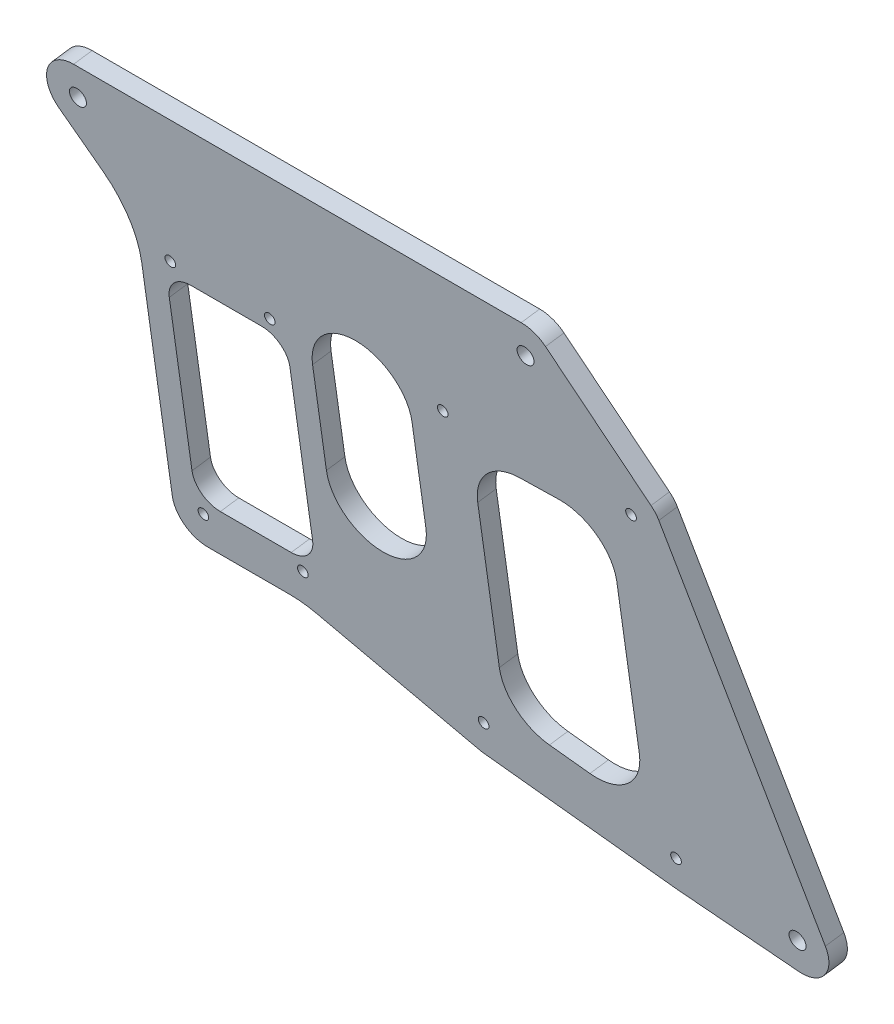
from build123d import *

# Parameters (mm, degrees)
SKETCH2_W                                         = 184.171135827
SKETCH2_H                                         = 127
BOSS_EXTRUDE1_DEPTH                               = 4.7625
CSK_FOR_6_FLAT_HEAD_MACHINE_SCREW_100_D           = 4.3053
CSK_FOR_6_FLAT_HEAD_MACHINE_SCREW_100_CSINK_D     = 7.0866
CSK_FOR_6_FLAT_HEAD_MACHINE_SCREW_100_CSINK_ANGLE = 100
CUT_EXTRUDE1_DEPTH                                = 2440.147405433
F_2_CLEARANCE_HOLE1_D                             = 2.7051
CUT_EXTRUDE2_DEPTH                                = 4.7625
FILLET1_R                                         = 25.4
SKETCH10_W                                        = 30.7975
SKETCH10_H                                        = 54.356
CUT_EXTRUDE3_DEPTH                                = 2440.147405433
FILLET2_R                                         = 6.35
CUT_EXTRUDE4_DEPTH                                = 2440.147405433
FILLET3_R                                         = 12.7


with BuildPart() as part:
    # Sketch2 → Boss-Extrude1 (new body)
    with BuildSketch(Plane(origin=(-1e-09, -851.606445574, 6059.494718221), x_dir=(-1, 0, 0), z_dir=(1.0892556339675399e-13, 0.13917310096006327, -0.9902680687415707))):
        with Locations((-199.574242123, -2357.490725166)):
            Rectangle(SKETCH2_W, SKETCH2_H)
    extrude(amount=BOSS_EXTRUDE1_DEPTH)

    # CSK for #6 Flat Head Machine Screw (100)1 (through all)
    with Locations(Plane(origin=(-1e-09, -850.94363368, 6054.778566544), x_dir=(-1, 0, 0), z_dir=(1.0707755897952407e-13, 0.13917310096005847, -0.9902680687415714))):
        with Locations((-115.42617421, -2301.928225166), (-229.72617421, -2301.928225166), (-283.722310037, -2413.053225166)):
            CounterSinkHole(CSK_FOR_6_FLAT_HEAD_MACHINE_SCREW_100_D / 2, CSK_FOR_6_FLAT_HEAD_MACHINE_SCREW_100_CSINK_D / 2, counter_sink_angle=CSK_FOR_6_FLAT_HEAD_MACHINE_SCREW_100_CSINK_ANGLE)

    # Sketch5 → Cut-Extrude1 (cut, through all)
    with BuildSketch(Plane(origin=(-1e-09, -850.94363368, 6054.778566544), x_dir=(-1, 0, 0), z_dir=(1.0707755897952407e-13, 0.13917310096005847, -0.9902680687415714))):
        with BuildLine():
            Line((-195.975000021, -2361.610724808), (-195.975000021, -2336.210724808))
            ThreePointArc((-195.975000021, -2336.210724808), (-183.275000021, -2323.510724808), (-170.575000021, -2336.210724808))
            Line((-170.575000021, -2336.210724808), (-170.575000021, -2361.610724808))
            ThreePointArc((-170.575000021, -2361.610724808), (-183.275000021, -2374.310724808), (-195.975000021, -2361.610724808))
        make_face()
    extrude(amount=-CUT_EXTRUDE1_DEPTH, mode=Mode.SUBTRACT)

    # #2 Clearance Hole1 (through all)
    with Locations(Plane(origin=(-1e-09, -850.94363368, 6054.778566544), x_dir=(-1, 0, 0), z_dir=(1.0707755897952407e-13, 0.13917310096005847, -0.9902680687415714))):
        with Locations((-135.015000021, -2391.392725166), (-160.415000021, -2391.392725166), (-160.415000021, -2330.686725166), (-135.015000021, -2330.686725166), (-204.864100021, -2328.675325166), (-204.864100021, -2403.605325166), (-253.124100021, -2409.955325166), (-253.124100021, -2327.405325166)):
            Hole(F_2_CLEARANCE_HOLE1_D / 2)

    # Sketch9 → Cut-Extrude2 (cut)
    with BuildSketch(Plane(origin=(-1e-09, -850.94363368, 6054.778566544), x_dir=(-1, 0, 0), z_dir=(1.0707755897952407e-13, 0.13917310096005847, -0.9902680687415714))):
        with BuildLine():
            Line((-252.324559302, -2417.852453814), (-282.922769318, -2420.950353814))
            ThreePointArc((-282.922769318, -2420.950353814), (-283.322030383, -2420.980625903), (-283.722310037, -2420.990725166))
            Line((-283.722310037, -2420.990725166), (-107.48867421, -2420.990725166))
            Line((-107.48867421, -2420.990725166), (-107.48867421, -2301.928225166))
            ThreePointArc((-107.48867421, -2301.928225166), (-108.092880421, -2304.96577491), (-109.813514134, -2307.540885241))
            Line((-109.813514134, -2307.540885241), (-127.077500021, -2324.804871128))
            Line((-127.077500021, -2324.804871128), (-127.077500021, -2391.392725166))
            ThreePointArc((-127.077500021, -2391.392725166), (-129.402339945, -2397.005385241), (-135.015000021, -2399.330225166))
            Line((-135.015000021, -2399.330225166), (-159.344404514, -2399.330225166))
            Line((-159.344404514, -2399.330225166), (-202.761165842, -2411.259185244))
            ThreePointArc((-202.761165842, -2411.259185244), (-203.291186027, -2411.385418213), (-203.828617327, -2411.474993637))
            Line((-203.828617327, -2411.474993637), (-252.088617327, -2417.824993637))
            ThreePointArc((-252.088617327, -2417.824993637), (-252.206485588, -2417.839606363), (-252.324559302, -2417.852453814))
        make_face()
        with BuildLine():
            Line((-291.659810037, -2293.990725166), (-291.659810037, -2413.053225166))
            ThreePointArc((-291.659810037, -2413.053225166), (-291.543281919, -2411.69812182), (-291.197118994, -2410.382806226))
            Line((-291.197118994, -2410.382806226), (-260.598908977, -2324.734906226))
            ThreePointArc((-260.598908977, -2324.734906226), (-259.919874258, -2323.303940185), (-258.970238667, -2322.036287154))
            Line((-258.970238667, -2322.036287154), (-235.572312857, -2296.559187154))
            ThreePointArc((-235.572312857, -2296.559187154), (-232.918913397, -2294.661154041), (-229.72617421, -2293.990725166))
            Line((-229.72617421, -2293.990725166), (-291.659810037, -2293.990725166))
        make_face()
        with BuildLine():
            ThreePointArc((-115.42617421, -2293.990725166), (-109.813514134, -2296.31556509), (-107.48867421, -2301.928225166))
            Line((-107.48867421, -2301.928225166), (-107.48867421, -2293.990725166))
            Line((-107.48867421, -2293.990725166), (-115.42617421, -2293.990725166))
        make_face()
        with BuildLine():
            Line((-291.659810037, -2420.990725166), (-283.722310037, -2420.990725166))
            ThreePointArc((-283.722310037, -2420.990725166), (-289.334970113, -2418.665885241), (-291.659810037, -2413.053225166))
            Line((-291.659810037, -2413.053225166), (-291.659810037, -2420.990725166))
        make_face()
    extrude(amount=-CUT_EXTRUDE2_DEPTH, mode=Mode.SUBTRACT)

    # Fillet1
    fillet1_edges = [part.edges().sort_by_distance(p)[0] for p in [
        (127.07750002, -3153.45506956, 5733.586339341),
        (159.344404514, -3227.255147975, 5723.214414719),
    ]]
    fillet(fillet1_edges, radius=FILLET1_R)

    # Sketch10 → Cut-Extrude3 (cut, through all)
    with BuildSketch(Plane(origin=(-1e-09, -850.94363368, 6054.778566544), x_dir=(-1, 0, 0), z_dir=(1.0707755897952407e-13, 0.13917310096005847, -0.9902680687415714))):
        with Locations((-148.826250021, -2361.039725166)):
            Rectangle(SKETCH10_W, SKETCH10_H)
    extrude(amount=-CUT_EXTRUDE3_DEPTH, mode=Mode.SUBTRACT)

    # Fillet2
    fillet2_edges = [part.edges().sort_by_distance(p)[0] for p in [
        (133.42750002, -3162.423782917, 5732.325868879),
        (133.42750002, -3216.250794061, 5724.760975804),
        (164.22500002, -3216.250794061, 5724.760975804),
        (164.22500002, -3162.423782917, 5732.325868879),
    ]]
    fillet(fillet2_edges, radius=FILLET2_R)

    # Sketch11 → Cut-Extrude4 (cut, through all)
    with BuildSketch(Plane(origin=(-1e-09, -850.94363368, 6054.778566544), x_dir=(-1, 0, 0), z_dir=(1.0707755897952407e-13, 0.13917310096005847, -0.9902680687415714))):
        Polygon((-246.774100021, -2333.924628802), (-246.774100021, -2402.715065895), (-211.214100021, -2398.036118527), (-211.214100021, -2334.860418276), align=None)
    extrude(amount=-CUT_EXTRUDE4_DEPTH, mode=Mode.SUBTRACT)

    # Fillet3
    fillet3_edges = [part.edges().sort_by_distance(p)[0] for p in [
        (246.77410002, -3162.486074379, 5732.317114385),
        (211.21410002, -3163.412756814, 5732.186877662),
        (211.21410002, -3225.973635493, 5723.394519553),
        (246.77410002, -3230.607047667, 5722.743335939),
    ]]
    fillet(fillet3_edges, radius=FILLET3_R)


solid = part.part
